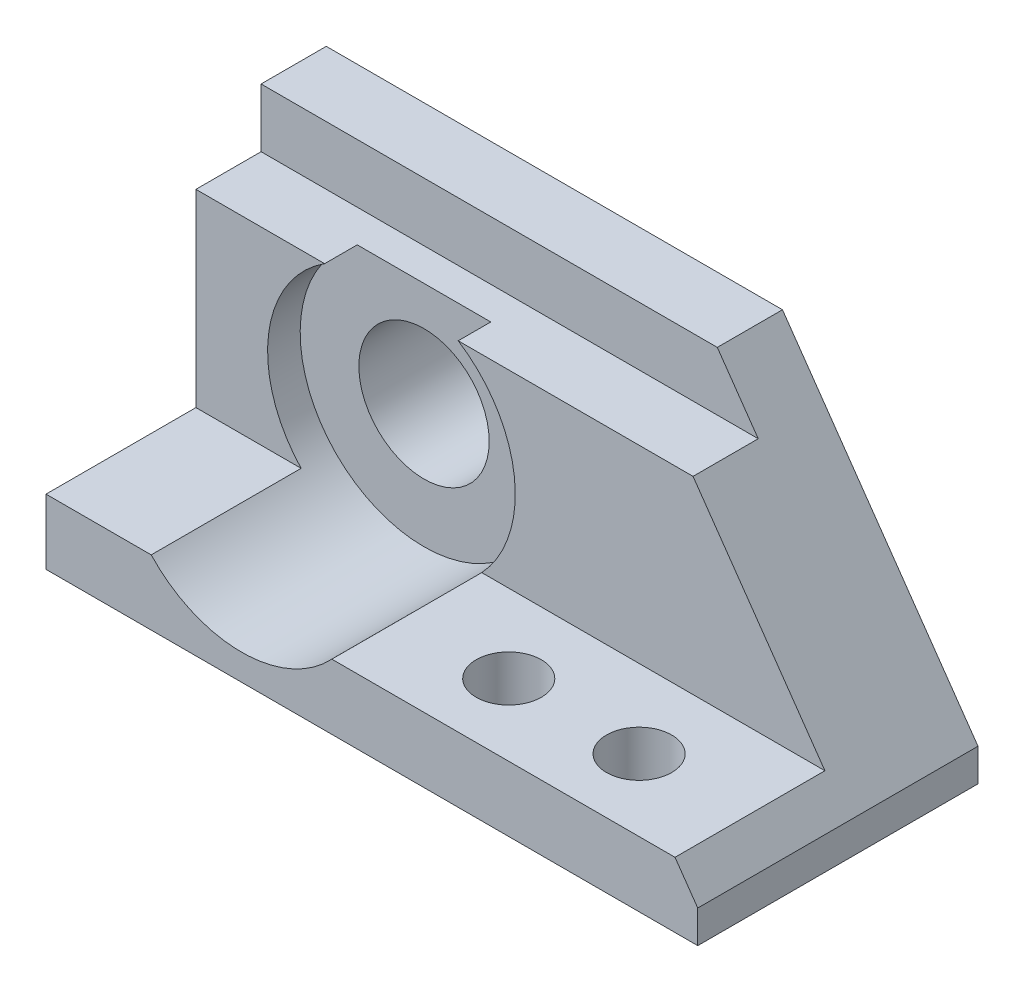
from build123d import *

# Parameters (mm, degrees)
ESTRUSIONE_ESTRUSIONE1_DEPTH  = 100
TAGLIO_ESTRUSIONE1_DEPTH      = 119.966381806
TAGLIO_ESTRUSIONE1_DEPTH_BACK = 119.966381806
TAGLIO_ESTRUSIONE2_DEPTH      = 142.966381806
TAGLIO_ESTRUSIONE2_DEPTH_BACK = 5
TAGLIO_ESTRUSIONE2_START      = -23
SCHIZZO3_R                    = 19
FORO_20_0_20_1_D              = 20
FORO_10_0_10_1_D              = 10


with BuildPart() as part:
    # Schizzo1 → Estrusione-Estrusione1 (new body)
    with BuildSketch(Plane(origin=(0, 0, 0), x_dir=(0, 0, -1), z_dir=(1, 0, 0))):
        Polygon((0, 48), (0, 0), (-43, 0), (-43, 10), (-20, 10), (-20, 39), (-10, 39), (-10, 48), align=None)
    extrude(amount=ESTRUSIONE_ESTRUSIONE1_DEPTH)

    # Schizzo2 → Taglio-Estrusione1 (cut, two sides: drawn at the far end of the back side and taken through both)
    with BuildSketch(Plane.XY.offset(-TAGLIO_ESTRUSIONE1_DEPTH_BACK)):
        Polygon((-60.289310715, 234.748012024), (70, 48), (100, 5), (230.289310715, -181.748012024), (603.785334763, 78.830609405), (313.206713334, 495.326633453), align=None)
    extrude(amount=TAGLIO_ESTRUSIONE1_DEPTH + TAGLIO_ESTRUSIONE1_DEPTH_BACK, mode=Mode.SUBTRACT)

    # Schizzo3 → Taglio-Estrusione2 (cut, two sides: drawn at the far end of the back side and taken through both)
    with BuildSketch(Plane.XY.offset(43).offset(TAGLIO_ESTRUSIONE2_START - TAGLIO_ESTRUSIONE2_DEPTH_BACK)):
        with Locations((30, 23)):
            Circle(SCHIZZO3_R)
    extrude(amount=TAGLIO_ESTRUSIONE2_DEPTH + TAGLIO_ESTRUSIONE2_DEPTH_BACK, mode=Mode.SUBTRACT)

    # Foro Ø20.0 (20)-1 (through all)
    with Locations(Plane.XY.offset(15)):
        with Locations((30, 23)):
            Hole(FORO_20_0_20_1_D / 2)

    # Foro Ø10.0 (10)-1 (through all)
    with Locations(Plane(origin=(0, 10, 0), x_dir=(1, 0, 0), z_dir=(0, 1, 0))):
        with Locations((80, -32), (60, -32)):
            Hole(FORO_10_0_10_1_D / 2)


solid = part.part
